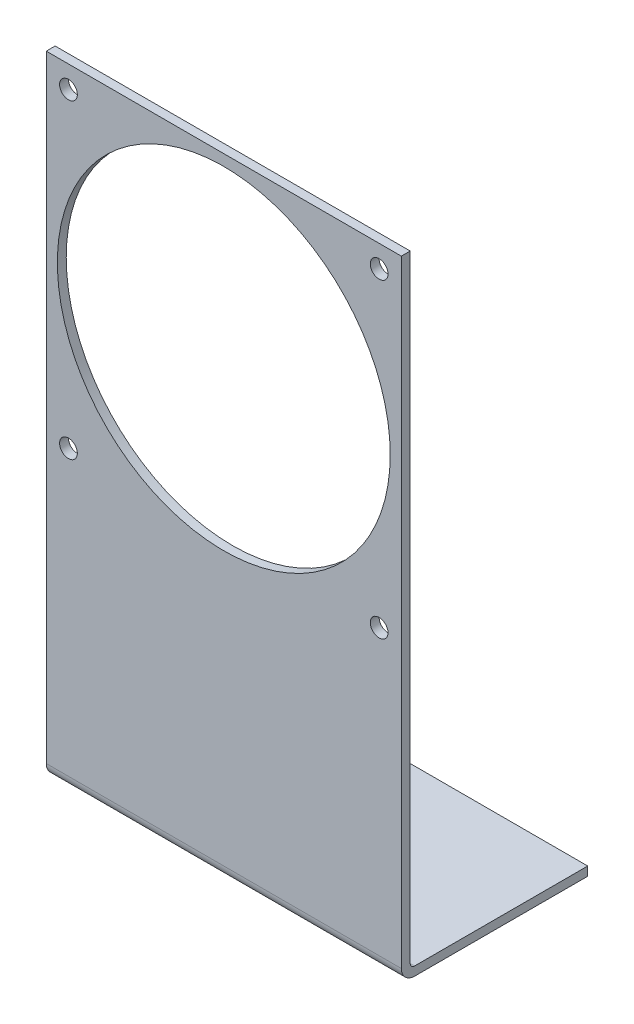
from build123d import *

# Parameters (mm, degrees)
SUPERFICIE_EXTRUIR1_1_DEPTH = 80
DAR_ESPESOR1_T1             = 2
CROQUIS2_R                  = 37.5
CROQUIS2_R_2                = 2
EXTRUIR1_DEPTH              = 80


with BuildPart() as body_1:
    # Superficie-Extruir1: a surface, the sketch's curves swept straight by 80 mm
    with BuildLine(Plane(origin=(0, 0, 0), x_dir=(0, 0, -1), z_dir=(1, 0, 0)), mode=Mode.PRIVATE) as superficie_extruir1_1_path:
        Line((0, 0), (-39, 0))
        ThreePointArc((-39, 0), (-39.707106781, 0.292893219), (-40, 1))
        Line((-40, 1), (-40, 140))
    superficie_extruir1_1 = Shell.extrude(superficie_extruir1_1_path.wire(), (1 * SUPERFICIE_EXTRUIR1_1_DEPTH, 0 * SUPERFICIE_EXTRUIR1_1_DEPTH, 0 * SUPERFICIE_EXTRUIR1_1_DEPTH))
    add(Solid.thicken(superficie_extruir1_1, DAR_ESPESOR1_T1))

    # Croquis2 → Extruir1 (cut)
    with BuildSketch(Plane.XY.offset(42)):
        with Locations((40, 100)):
            Circle(CROQUIS2_R)
        with Locations((5, 135)):
            Circle(CROQUIS2_R_2)
        with Locations(Location((75, 135, 0), (0, 0, 180))):
            Circle(CROQUIS2_R_2)
        with Locations((75, 65)):
            Circle(CROQUIS2_R_2)
        with Locations(Location((5, 65, 0), (0, 0, 180))):
            Circle(CROQUIS2_R_2)
    extrude(amount=-EXTRUIR1_DEPTH, mode=Mode.SUBTRACT)


solid = body_1.part
